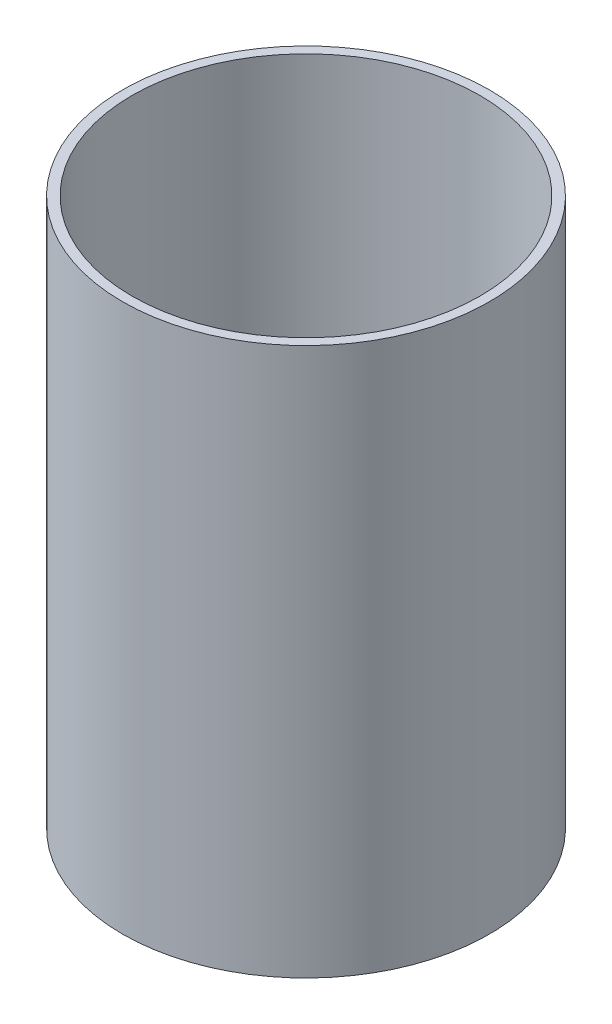
from build123d import *

# Parameters (mm, degrees)
SKETCH1_R           = 33.5
BOSS_EXTRUDE1_DEPTH = 100
SKETCH2_R           = 31.75
CUT_EXTRUDE1_DEPTH  = 98


with BuildPart() as part:
    # Sketch1 → Boss-Extrude1 (new body)
    with BuildSketch(Plane(origin=(0, 0, 0), x_dir=(1, 0, 0), z_dir=(0, 1, 0))):
        with Locations(Location((0, 0, 0), (0, 0, 270))):
            Circle(SKETCH1_R)
    extrude(amount=BOSS_EXTRUDE1_DEPTH)

    # Sketch2 → Cut-Extrude1 (cut)
    with BuildSketch(Plane(origin=(0, 100, 0), x_dir=(1, 0, 0), z_dir=(0, 1, 0))):
        with Locations(Location((0, 0, 0), (0, 0, 270))):
            Circle(SKETCH2_R)
    extrude(amount=-CUT_EXTRUDE1_DEPTH, mode=Mode.SUBTRACT)


solid = part.part
